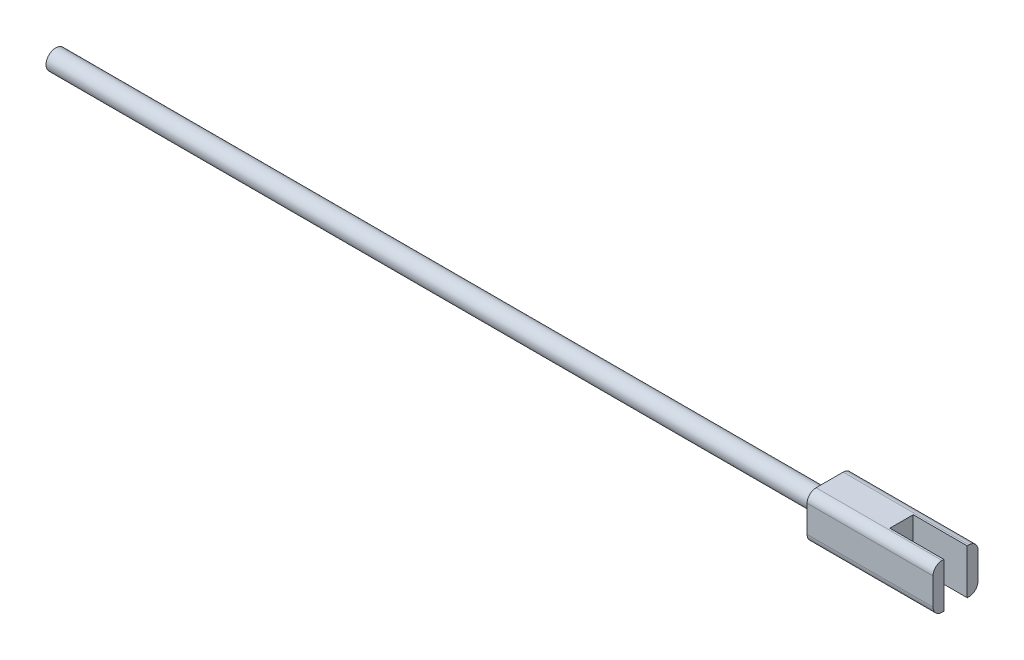
from build123d import *

# Parameters (mm, degrees)
SKETCH1_R               = 1.09
BOSS_EXTRUDE1_DEPTH     = 88.041
BOSS_EXTRUDE2_DEPTH     = 14
CUT_EXTRUDE1_DEPTH      = 101.10345489
CUT_EXTRUDE1_DEPTH_BACK = 101.10345489
SKETCH3_W               = 7
SKETCH3_H               = 2.6


with BuildPart() as part:
    # Sketch1 → Boss-Extrude1 (new body)
    with BuildSketch(Plane(origin=(0, 0, 0), x_dir=(0, 0, -1), z_dir=(1, 0, 0))):
        Circle(SKETCH1_R)
    extrude(amount=BOSS_EXTRUDE1_DEPTH)

    # Sketch2 → Boss-Extrude2 (add)
    with BuildSketch(Plane(origin=(86.041, 0, 0), x_dir=(0, 0, -1), z_dir=(1, 0, 0))):
        with BuildLine():
            Line((-1.5, -2.5), (1.5, -2.5))
            ThreePointArc((1.5, -2.5), (2.207106781, -2.207106781), (2.5, -1.5))
            Line((2.5, -1.5), (2.5, 1.5))
            ThreePointArc((2.5, 1.5), (2.207106781, 2.207106781), (1.5, 2.5))
            Line((1.5, 2.5), (-1.5, 2.5))
            ThreePointArc((-1.5, 2.5), (-2.207106781, 2.207106781), (-2.5, 1.5))
            Line((-2.5, 1.5), (-2.5, -1.5))
            ThreePointArc((-2.5, -1.5), (-2.207106781, -2.207106781), (-1.5, -2.5))
        make_face()
    extrude(amount=BOSS_EXTRUDE2_DEPTH)

    # Sketch3 → Cut-Extrude1 (cut, two sides: drawn at the far end of the back side and taken through both)
    with BuildSketch(Plane(origin=(0, 0, 0), x_dir=(1, 0, 0), z_dir=(0, 1, 0)).offset(-CUT_EXTRUDE1_DEPTH_BACK)):
        with Locations((97.541, 0)):
            Rectangle(SKETCH3_W, SKETCH3_H)
    extrude(amount=CUT_EXTRUDE1_DEPTH + CUT_EXTRUDE1_DEPTH_BACK, mode=Mode.SUBTRACT)


solid = part.part
